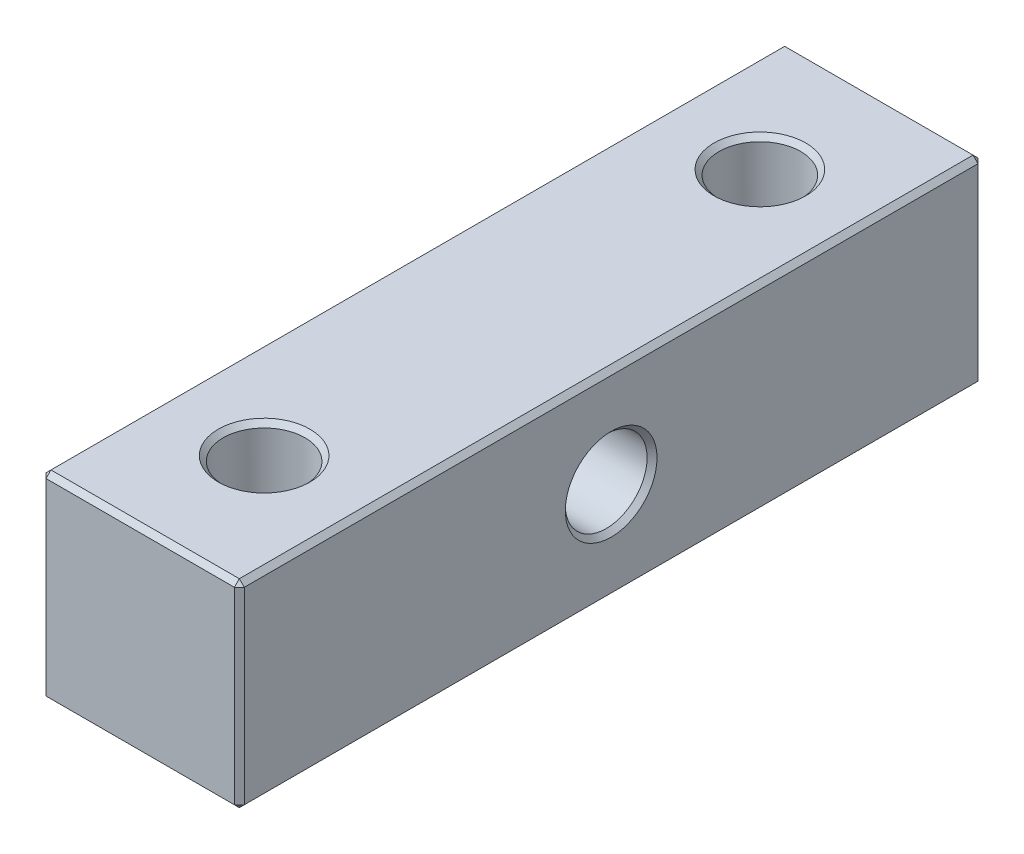
from build123d import *

# Parameters (mm, degrees)
SKETCH_1_W         = 8
SKETCH_1_H         = 8
EXTRUDE_1_DEPTH    = 15
HOLE_WIZARD_M4_1_D = 3.3
HOLE_WIZARD_M4_2_D = 3.3
CHAMFER_1_SIZE     = 0.2


with BuildPart() as part:
    # 草图1 → 凸台-拉伸1 (new, symmetric)
    with BuildSketch(Plane.XY):
        Rectangle(SKETCH_1_W, SKETCH_1_H)
    extrude(amount=EXTRUDE_1_DEPTH, both=True)

    # M4 螺纹孔1 (through all)
    with Locations(Plane(origin=(4, 0, 0), x_dir=(0, 0, -1), z_dir=(1, 0, 0))):
        with Locations((0, 0)):
            Hole(HOLE_WIZARD_M4_1_D / 2)

    # M4 螺纹孔2 (through all)
    with Locations(Plane(origin=(0, 4, 0), x_dir=(1, 0, 0), z_dir=(0, 1, 0))):
        with Locations((0, -10), (0, 10)):
            Hole(HOLE_WIZARD_M4_2_D / 2)

    # 倒角1
    chamfer_1_edges = [part.edges().sort_by_distance(p)[0] for p in [
        (-4, 0, 15),
        (4, 0, -1.65),
        (-4, 0, -1.65),
        (0, -4, 15),
        (1.65, 4, -10),
        (1.65, -4, -10),
        (1.65, 4, 10),
        (1.65, -4, 10),
        (4, 0, 15),
        (0, -4, -15),
        (-4, 0, -15),
        (0, 4, -15),
        (4, 0, -15),
        (4, -4, 0),
        (-4, -4, 0),
        (-4, 4, 0),
        (4, 4, 0),
        (0, 4, 15),
    ]]
    chamfer(chamfer_1_edges, length=CHAMFER_1_SIZE)


solid = part.part
